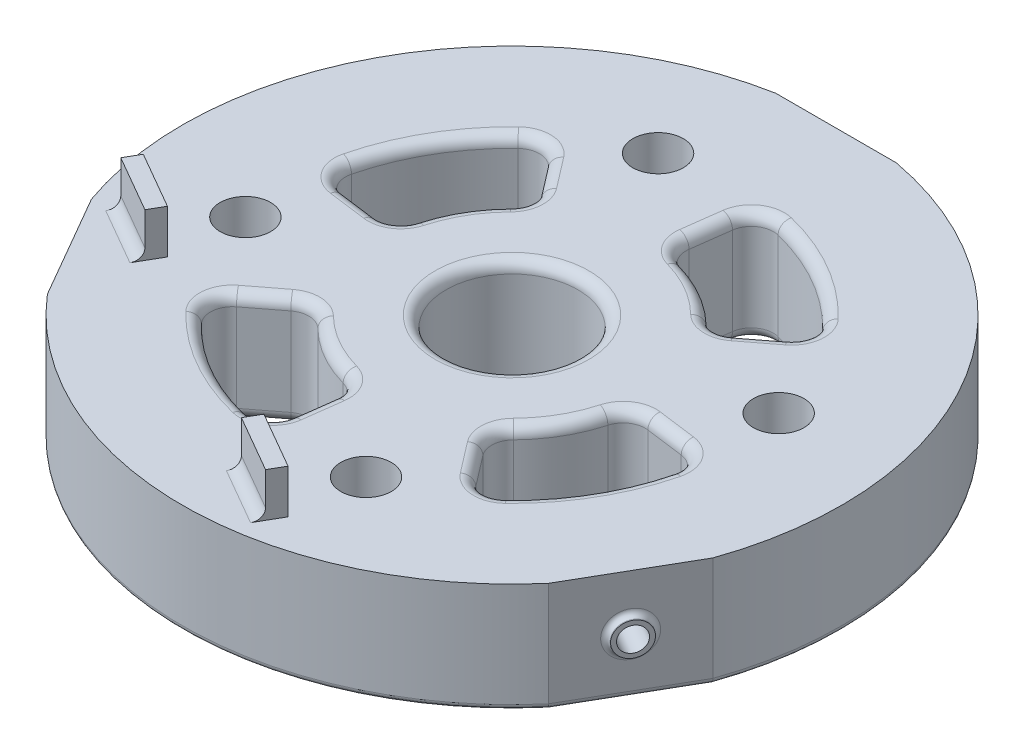
from build123d import *

# Parameters (mm, degrees)
EXTRUDE_1_DEPTH          = 10
SKETCH_2_R               = 1.1
CUT_EXTRUDE_1_DEPTH      = 10
PATTERN_CIRCULAR_1_COUNT = 3
EXTRUDE_START            = 0.6
SKETCH_4_R               = 1.5
SKETCH_4_R_2             = 1.1
EXTRUDE_2_DEPTH          = 0.6
FILLET_1_R               = 0.5
PATTERN_CIRCULAR_2_COUNT = 3
FILLET_2_R               = 0.5
EXTRUDE_START_2          = -10
SKETCH_5_R               = 25
EXTRUDE_3_DEPTH          = 10
SKETCH_6_R               = 2.3
CUT_EXTRUDE_3_DEPTH      = 10
SKETCH_7_R               = 3.65
CUT_EXTRUDE_4_DEPTH      = 4
EXTRUDE_4_DEPTH          = 4
FILLET_3_R               = 1
FILLET_4_R               = 0.5
SKETCH_9_R               = 6
CUT_EXTRUDE_5_DEPTH      = 34
FILLET_5_R               = 2
FILLET_6_R               = 1


with BuildPart() as part:
    # 草图1 → 凸台-拉伸1 (new body)
    with BuildSketch(Plane(origin=(0, 0, 0), x_dir=(1, 0, 0), z_dir=(0, 1, 0))):
        with BuildLine():
            Line((-5.481881586, 29.494897428), (5.481881586, 29.494897428))
            ThreePointArc((5.481881586, 29.494897428), (25.980762114, 15), (28.284271247, -10))
            Line((28.284271247, -10), (22.802389662, -19.494897428))
            ThreePointArc((22.802389662, -19.494897428), (0, -30), (-22.802389662, -19.494897428))
            Line((-22.802389662, -19.494897428), (-28.284271247, -10))
            ThreePointArc((-28.284271247, -10), (-25.980762114, 15), (-5.481881586, 29.494897428))
        make_face()
        with BuildLine():
            Line((-5, 24.494897428), (5, 24.494897428))
            ThreePointArc((5, 24.494897428), (21.650635095, 12.5), (23.713203436, -7.917321695))
            Line((23.713203436, -7.917321695), (18.713203436, -16.577575733))
            ThreePointArc((18.713203436, -16.577575733), (0, -25), (-18.713203436, -16.577575733))
            Line((-18.713203436, -16.577575733), (-23.713203436, -7.917321695))
            ThreePointArc((-23.713203436, -7.917321695), (-21.650635095, 12.5), (-5, 24.494897428))
        make_face(mode=Mode.SUBTRACT)
    extrude(amount=EXTRUDE_1_DEPTH)

    # 草图2 → 切除-拉伸1 (cut)
    with BuildSketch(Plane(origin=(25.543330455, 0, 14.747448714), x_dir=(0.4999999999999994, 0, -0.866025403784439), z_dir=(0.866025403784439, 0, 0.4999999999999994))):
        with Locations((0, 5)):
            Circle(SKETCH_2_R)
    cut_extrude_1 = extrude(amount=-CUT_EXTRUDE_1_DEPTH, mode=Mode.SUBTRACT)

    # 阵列(圆周)1: 切除-拉伸1 ×3 about axis
    pattern_circular_1_axis = Axis((0, 10, 0), (0, -1, 0))
    for i in range(1, PATTERN_CIRCULAR_1_COUNT):
        add(cut_extrude_1.rotate(pattern_circular_1_axis, i * 360 / PATTERN_CIRCULAR_1_COUNT), mode=Mode.SUBTRACT)

    # 草图4 → 凸台-拉伸2 (add)
    with BuildSketch(Plane(origin=(25.543330455, 0, 14.747448714), x_dir=(0.49999999999999967, 0, -0.8660254037844388), z_dir=(0.8660254037844388, 0, 0.49999999999999967)).offset(EXTRUDE_START)):
        with Locations(Location((0, 5, 0), (0, 0, 180))):
            Circle(SKETCH_4_R)
        with Locations((0, 5)):
            Circle(SKETCH_4_R_2, mode=Mode.SUBTRACT)
    extrude_2 = extrude(amount=-EXTRUDE_2_DEPTH)

    # 圆角1
    fillet_1_edges = [part.edges().sort_by_distance(p)[0] for p in [
        (26.293330455, 5, 13.448410608),
    ]]
    fillet(fillet_1_edges, radius=FILLET_1_R)

    # 阵列(圆周)2: 凸台-拉伸2 ×3 about axis
    pattern_circular_2_axis = Axis((0, 0, 0), (0, 1, 0))
    for i in range(1, PATTERN_CIRCULAR_2_COUNT):
        add(extrude_2.rotate(pattern_circular_2_axis, i * 360 / PATTERN_CIRCULAR_2_COUNT))

    # 圆角2
    fillet_2_edges = [part.edges().sort_by_distance(p)[0] for p in [
        (-24.793330455, 5, 16.04648682),
        (-1.5, 5, -29.494897428),
    ]]
    fillet(fillet_2_edges, radius=FILLET_2_R)

    # 草图5 → 凸台-拉伸3 (add)
    with BuildSketch(Plane(origin=(0, 10, 0), x_dir=(1, 0, 0), z_dir=(0, 1, 0)).offset(EXTRUDE_START_2)):
        Circle(SKETCH_5_R)
    extrude(amount=EXTRUDE_3_DEPTH)

    # 草图6 → 切除-拉伸3 (cut)
    with BuildSketch(Plane(origin=(0, 10, 0), x_dir=(1, 0, 0), z_dir=(0, 1, 0))):
        with Locations(Location((-6.115381057, 19.407849302, 0), (0, 0, 270))):
            Circle(SKETCH_6_R)
        with Locations(Location((19.865381057, 4.407849302, 0), (0, 0, 90))):
            Circle(SKETCH_6_R)
        with Locations(Location((6.115381057, -19.407849302, 0), (0, 0, 270))):
            Circle(SKETCH_6_R)
        with Locations(Location((-19.865381057, -4.407849302, 0), (0, 0, 90))):
            Circle(SKETCH_6_R)
    extrude(amount=-CUT_EXTRUDE_3_DEPTH, mode=Mode.SUBTRACT)

    # 草图7 → 切除-拉伸4 (cut)
    with BuildSketch(Plane.XZ):
        with Locations(Location((-19.865381057, 4.407849302, 0), (0, 0, 270))):
            Circle(SKETCH_7_R)
        with Locations(Location((6.115381057, 19.407849302, 0), (0, 0, 270))):
            Circle(SKETCH_7_R)
        with Locations(Location((19.865381057, -4.407849302, 0), (0, 0, 270))):
            Circle(SKETCH_7_R)
        with Locations(Location((-6.115381057, -19.407849302, 0), (0, 0, 270))):
            Circle(SKETCH_7_R)
    extrude(amount=-CUT_EXTRUDE_4_DEPTH, mode=Mode.SUBTRACT)

    # 草图8 → 凸台-拉伸4 (add)
    with BuildSketch(Plane(origin=(0, 10, 0), x_dir=(1, 0, 0), z_dir=(0, 1, 0))):
        Polygon((-20.267304845, -11.104001725), (-21.017304845, -12.40303983), (-26.213457268, -9.40303983), (-25.463457268, -8.104001725), align=None)
        Polygon((0.517304845, -23.104001725), (5.713457268, -26.104001725), (4.963457268, -27.40303983), (-0.232695155, -24.40303983), align=None)
    extrude(amount=EXTRUDE_4_DEPTH)

    # 圆角3
    fillet_3_edges = [part.edges().sort_by_distance(p)[0] for p in [
        (-23.615381057, 10, 10.90303983),
        (2.365381057, 10, 25.90303983),
    ]]
    fillet(fillet_3_edges, radius=FILLET_3_R)

    # 圆角4
    fillet_4_edges = [part.edges().sort_by_distance(p)[0] for p in [
        (-19.865381057, 0, 8.057849302),
        (6.115381057, 0, 23.057849302),
        (19.865381057, 0, -0.757849302),
        (-6.115381057, 0, -15.757849302),
        (0, 0, -29.494897428),
        (25.980762114, 0, -15),
        (25.543330455, 0, 14.747448714),
        (0, 0, 30),
        (-25.543330455, 0, 14.747448714),
        (-25.980762114, 0, -15),
    ]]
    fillet(fillet_4_edges, radius=FILLET_4_R)

    # 草图9 → 切除-拉伸5 (cut)
    with BuildSketch(Plane.XZ):
        with Locations(Location((0, 0, 0), (0, 0, 270))):
            Circle(SKETCH_9_R)
        with BuildLine():
            Line((12.393060767, 1.631577403), (19.828897227, 2.610523844))
            ThreePointArc((19.828897227, 2.610523844), (17.320508076, 10), (12.17522858, 15.867066806))
            Line((12.17522858, 15.867066806), (7.609517863, 9.916916754))
            ThreePointArc((7.609517863, 9.916916754), (10.825317547, 6.25), (12.393060767, 1.631577403))
        make_face()
        with BuildLine():
            Line((-1.631577403, 12.393060767), (-2.610523844, 19.828897227))
            ThreePointArc((-2.610523844, 19.828897227), (-10, 17.320508076), (-15.867066806, 12.17522858))
            Line((-15.867066806, 12.17522858), (-9.916916754, 7.609517863))
            ThreePointArc((-9.916916754, 7.609517863), (-6.25, 10.825317547), (-1.631577403, 12.393060767))
        make_face()
        with BuildLine():
            Line((-12.393060767, -1.631577403), (-19.828897227, -2.610523844))
            ThreePointArc((-19.828897227, -2.610523844), (-17.320508076, -10), (-12.17522858, -15.867066806))
            Line((-12.17522858, -15.867066806), (-7.609517863, -9.916916754))
            ThreePointArc((-7.609517863, -9.916916754), (-10.825317547, -6.25), (-12.393060767, -1.631577403))
        make_face()
        with BuildLine():
            Line((9.916916754, -7.609517863), (15.867066806, -12.17522858))
            ThreePointArc((15.867066806, -12.17522858), (10, -17.320508076), (2.610523844, -19.828897227))
            Line((2.610523844, -19.828897227), (1.631577403, -12.393060767))
            ThreePointArc((1.631577403, -12.393060767), (6.25, -10.825317547), (9.916916754, -7.609517863))
        make_face()
    extrude(amount=-CUT_EXTRUDE_5_DEPTH, mode=Mode.SUBTRACT)

    # 圆角5
    fillet_5_edges = [part.edges().sort_by_distance(p)[0] for p in [
        (12.17522858, 5, 15.867066806),
        (19.828897227, 5, 2.610523844),
        (12.393060767, 5, 1.631577403),
        (7.609517863, 5, 9.916916754),
        (-12.17522858, 5, -15.867066806),
        (-19.828897227, 5, -2.610523844),
        (-12.393060767, 5, -1.631577403),
        (-7.609517863, 5, -9.916916754),
        (-15.867066806, 5, 12.17522858),
        (-2.610523844, 5, 19.828897227),
        (-1.631577403, 5, 12.393060767),
        (-9.916916754, 5, 7.609517863),
        (15.867066806, 5, -12.17522858),
        (2.610523844, 5, -19.828897227),
        (1.631577403, 5, -12.393060767),
        (9.916916754, 5, -7.609517863),
    ]]
    fillet(fillet_5_edges, radius=FILLET_5_R)

    # 圆角6
    fillet_6_edges = [part.edges().sort_by_distance(p)[0] for p in [
        (0, 10, 6),
        (0, 0, 6),
        (6.25, 10, -10.825317547),
        (6.25, 0, -10.825317547),
        (12.792802951, 10, -9.816262957),
        (12.792802951, 0, -9.816262957),
        (2.104731615, 10, -15.98702382),
        (2.104731615, 0, -15.98702382),
        (10, 10, -17.320508076),
        (10, 0, -17.320508076),
        (-10.825317547, 10, -6.25),
        (-10.825317547, 0, -6.25),
        (-9.816262957, 10, -12.792802951),
        (-9.816262957, 0, -12.792802951),
        (-15.98702382, 10, -2.104731615),
        (-15.98702382, 0, -2.104731615),
        (-17.320508076, 10, -10),
        (-17.320508076, 0, -10),
        (-12.792802951, 10, 9.816262957),
        (-12.792802951, 0, 9.816262957),
        (-10, 10, 17.320508076),
        (-10, 0, 17.320508076),
        (-6.25, 10, 10.825317547),
        (-6.25, 0, 10.825317547),
        (-2.104731615, 10, 15.98702382),
        (-2.104731615, 0, 15.98702382),
        (10.825317547, 10, 6.25),
        (10.825317547, 0, 6.25),
        (9.816262957, 10, 12.792802951),
        (9.816262957, 0, 12.792802951),
        (15.98702382, 10, 2.104731615),
        (15.98702382, 0, 2.104731615),
        (17.320508076, 10, 10),
        (17.320508076, 0, 10),
        (10.052798174, 0, -8.333184455),
        (10.052798174, 10, -8.333184455),
        (2.190350346, 0, -12.872570825),
        (2.190350346, 10, -12.872570825),
        (3.190463709, 0, -19.126446124),
        (3.190463709, 10, -19.126446124),
        (14.968756373, 0, -12.326245684),
        (14.968756373, 10, -12.326245684),
        (-8.333184455, 0, -10.052798174),
        (-8.333184455, 10, -10.052798174),
        (-12.872570825, 0, -2.190350346),
        (-12.872570825, 10, -2.190350346),
        (-12.326245684, 0, -14.968756373),
        (-12.326245684, 10, -14.968756373),
        (-19.126446124, 0, -3.190463709),
        (-19.126446124, 10, -3.190463709),
        (-14.968756373, 0, 12.326245684),
        (-14.968756373, 10, 12.326245684),
        (-10.052798174, 0, 8.333184455),
        (-10.052798174, 10, 8.333184455),
        (-3.190463709, 0, 19.126446124),
        (-3.190463709, 10, 19.126446124),
        (-2.190350346, 0, 12.872570825),
        (-2.190350346, 10, 12.872570825),
        (8.333184455, 0, 10.052798174),
        (8.333184455, 10, 10.052798174),
        (12.872570825, 0, 2.190350346),
        (12.872570825, 10, 2.190350346),
        (19.126446124, 0, 3.190463709),
        (19.126446124, 10, 3.190463709),
        (12.326245684, 0, 14.968756373),
        (12.326245684, 10, 14.968756373),
    ]]
    fillet(fillet_6_edges, radius=FILLET_6_R)


solid = part.part
